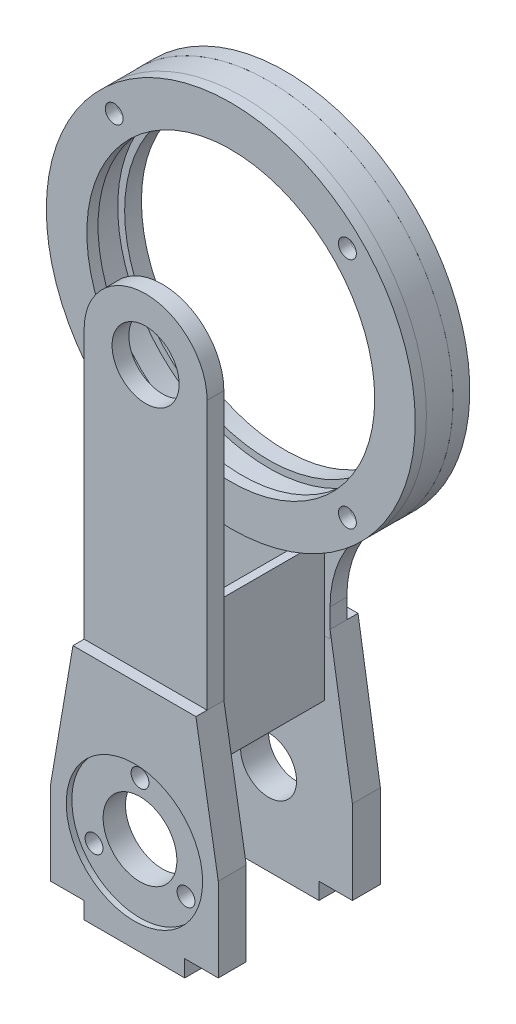
from build123d import *

# Parameters (mm, degrees)
SKETCH_4_R           = 6.6
SKETCH_4_R_2         = 1.6
EXTRUDE_1_DEPTH      = 5
SKETCH_7_R           = 5
EXTRUDE_2_DEPTH      = 5
EXTRUDE_3_DEPTH      = 15
EXTRUDE_3_DEPTH_BACK = 10
SKETCH_8_W           = 20
SKETCH_8_H           = 20
SKETCH_8_W_2         = 17
SKETCH_8_H_2         = 17
EXTRUDE_4_DEPTH      = 2.5
EXTRUDE_4_DEPTH_BACK = 0.5
SKETCH_9_R           = 25.75
SKETCH_9_R_2         = 1.6
SKETCH_10_R          = 33
SKETCH_10_R_2        = 26.9875
SKETCH_10_R_3        = 1.6
EXTRUDE_5_DEPTH      = 4.763
SKETCH_11_R          = 33
SKETCH_11_R_2        = 25.75
SKETCH_11_R_3        = 1.6
EXTRUDE_6_DEPTH      = 2
SKETCH_12_R          = 12.2
CUT_EXTRUDE_1_DEPTH  = 1
EXTRUDE_7_DEPTH      = 2.5
EXTRUDE_7_DEPTH_BACK = 0.5
SKETCH_13_R          = 6


with BuildPart() as part:
    # ｽｹｯﾁ4 → ﾎﾞｽ - 押し出し1 (new body)
    with BuildSketch(Plane.XY.offset(9.5)):
        Polygon((-15, 0), (-9, 0), (-9, -3), (9, -3), (9, 0), (15, 0), (15, 15), (11, 38.5), (-11, 38.5), (-15, 15), align=None)
        with Locations((0, 13.5)):
            Circle(SKETCH_4_R, mode=Mode.SUBTRACT)
        with Locations((0, 23)):
            Circle(SKETCH_4_R_2, mode=Mode.SUBTRACT)
        with Locations((8.227241336, 8.75)):
            Circle(SKETCH_4_R_2, mode=Mode.SUBTRACT)
        with Locations((-8.227241336, 8.75)):
            Circle(SKETCH_4_R_2, mode=Mode.SUBTRACT)
    extrude(amount=EXTRUDE_1_DEPTH)

    # ｽｹｯﾁ12 → ｶｯﾄ - 押し出し1 (cut)
    with BuildSketch(Plane.XY.offset(14.5)):
        with Locations((0, 13.5)):
            Circle(SKETCH_12_R)
    extrude(amount=-CUT_EXTRUDE_1_DEPTH, mode=Mode.SUBTRACT)


with BuildPart() as body_2:
    # ｽｹｯﾁ7 → ﾎﾞｽ - 押し出し2 (new body)
    with BuildSketch(Plane.XY.offset(-9.5)):
        Polygon((15, 0), (9, 0), (9, -3), (-9, -3), (-9, 0), (-15, 0), (-15, 15), (-11, 40), (11, 40), (15, 15), align=None)
        with Locations((0, 13.5)):
            Circle(SKETCH_7_R, mode=Mode.SUBTRACT)
    extrude(amount=-EXTRUDE_2_DEPTH)


with BuildPart() as body_3:
    # ｽｹｯﾁ8 → ﾎﾞｽ - 押し出し3 (new, two sides: drawn at the far end of the back side and taken through both)
    with BuildSketch(Plane(origin=(0, 38.5, 0), x_dir=(1, 0, 0), z_dir=(0, 1, 0)).offset(-EXTRUDE_3_DEPTH_BACK)):
        Rectangle(SKETCH_8_W, SKETCH_8_H)
        Rectangle(SKETCH_8_W_2, SKETCH_8_H_2, mode=Mode.SUBTRACT)
    extrude(amount=EXTRUDE_3_DEPTH + EXTRUDE_3_DEPTH_BACK)


with BuildPart() as body_4:
    # ｽｹｯﾁ9 → ﾎﾞｽ - 押し出し4 (new, two sides: drawn at the far end of the back side and taken through both)
    with BuildSketch(Plane(origin=(0, 0, -10), x_dir=(-1, 0, 0), z_dir=(0, 0, -1)).offset(-EXTRUDE_4_DEPTH_BACK)):
        with BuildLine():
            Line((-11, 38.5), (-11, 43.51162948))
            ThreePointArc((-11, 43.51162948), (-13.196036057, 52.623098512), (-19.301886792, 59.733656091))
            ThreePointArc((-19.301886792, 59.733656091), (0, 119.5), (19.301886792, 59.733656091))
            ThreePointArc((19.301886792, 59.733656091), (13.196036057, 52.623098512), (11, 43.51162948))
            Line((11, 43.51162948), (11, 38.5))
            Line((11, 38.5), (-11, 38.5))
        make_face()
        with Locations((0, 86.5)):
            Circle(SKETCH_9_R, mode=Mode.SUBTRACT)
        with Locations((-20.859650045, 107.359650045)):
            Circle(SKETCH_9_R_2, mode=Mode.SUBTRACT)
        with Locations((20.859650045, 107.359650045)):
            Circle(SKETCH_9_R_2, mode=Mode.SUBTRACT)
        with Locations((20.859650045, 65.640349955)):
            Circle(SKETCH_9_R_2, mode=Mode.SUBTRACT)
        with Locations((-20.859650045, 65.640349955)):
            Circle(SKETCH_9_R_2, mode=Mode.SUBTRACT)
    extrude(amount=EXTRUDE_4_DEPTH + EXTRUDE_4_DEPTH_BACK)


with BuildPart() as body_5:
    # ｽｹｯﾁ10 → ﾎﾞｽ - 押し出し5 (new body)
    with BuildSketch(Plane.XY.offset(-9.5)):
        with Locations((0, 86.5)):
            Circle(SKETCH_10_R)
        with Locations((0, 86.5)):
            Circle(SKETCH_10_R_2, mode=Mode.SUBTRACT)
        with Locations((-20.859650045, 65.640349955)):
            Circle(SKETCH_10_R_3, mode=Mode.SUBTRACT)
        with Locations((20.859650045, 65.640349955)):
            Circle(SKETCH_10_R_3, mode=Mode.SUBTRACT)
        with Locations((20.859650045, 107.359650045)):
            Circle(SKETCH_10_R_3, mode=Mode.SUBTRACT)
        with Locations((-20.859650045, 107.359650045)):
            Circle(SKETCH_10_R_3, mode=Mode.SUBTRACT)
    extrude(amount=EXTRUDE_5_DEPTH)


with BuildPart() as body_6:
    # ｽｹｯﾁ11 → ﾎﾞｽ - 押し出し6 (new body)
    with BuildSketch(Plane.XY.offset(-4.737)):
        with Locations((0, 86.5)):
            Circle(SKETCH_11_R)
        with Locations((0, 86.5)):
            Circle(SKETCH_11_R_2, mode=Mode.SUBTRACT)
        with Locations((20.859650045, 65.640349955)):
            Circle(SKETCH_11_R_3, mode=Mode.SUBTRACT)
        with Locations((-20.859650045, 65.640349955)):
            Circle(SKETCH_11_R_3, mode=Mode.SUBTRACT)
        with Locations((-20.859650045, 107.359650045)):
            Circle(SKETCH_11_R_3, mode=Mode.SUBTRACT)
        with Locations((20.859650045, 107.359650045)):
            Circle(SKETCH_11_R_3, mode=Mode.SUBTRACT)
    extrude(amount=EXTRUDE_6_DEPTH)


with BuildPart() as body_7:
    # ｽｹｯﾁ13 → ﾎﾞｽ - 押し出し7 (new, two sides: drawn at the far end of the back side and taken through both)
    with BuildSketch(Plane.XY.offset(10).offset(-EXTRUDE_7_DEPTH_BACK)):
        with BuildLine():
            Line((-11, 38.5), (11, 38.5))
            Line((11, 38.5), (11, 86.5))
            ThreePointArc((11, 86.5), (0, 97.5), (-11, 86.5))
            Line((-11, 86.5), (-11, 38.5))
        make_face()
        with Locations((0, 86.5)):
            Circle(SKETCH_13_R, mode=Mode.SUBTRACT)
    extrude(amount=EXTRUDE_7_DEPTH + EXTRUDE_7_DEPTH_BACK)


solid = Compound([part.part, body_2.part, body_3.part, body_4.part, body_5.part, body_6.part, body_7.part])
